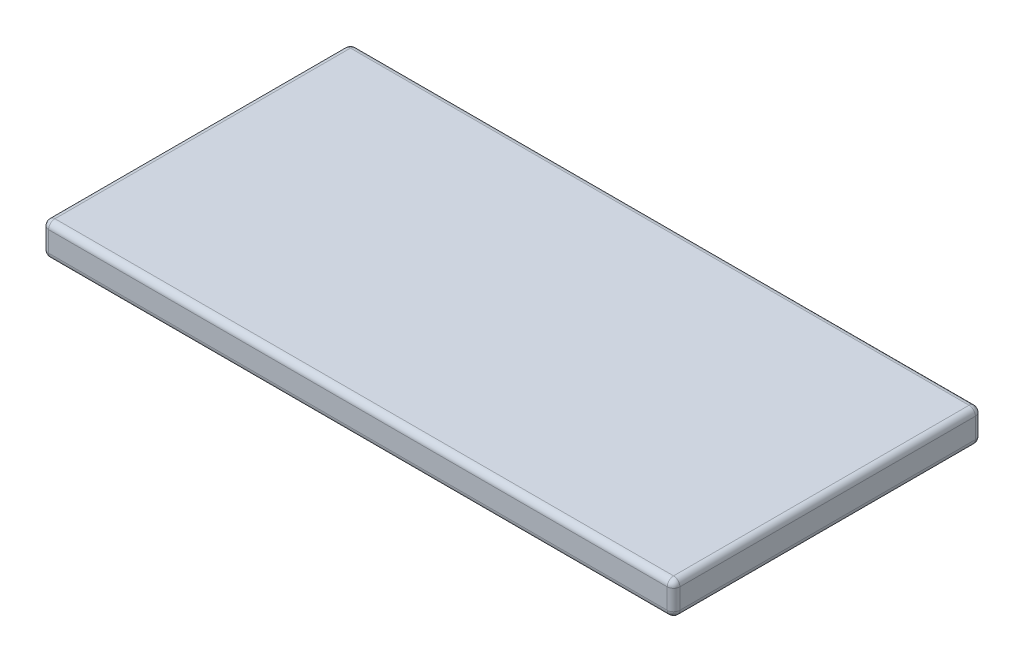
from build123d import *

# Parameters (mm, degrees)
SKETCH_1_W      = 99.64
SKETCH_1_H      = 48.64
EXTRUDE_1_DEPTH = 5.2
FILLET_1_R      = 1


with BuildPart() as part:
    # 草图1 → 凸台-拉伸1 (new body)
    with BuildSketch(Plane(origin=(0, 0, 0), x_dir=(1, 0, 0), z_dir=(0, 1, 0))):
        Rectangle(SKETCH_1_W, SKETCH_1_H)
    extrude(amount=EXTRUDE_1_DEPTH)

    # 圆角1
    fillet_1_edges = [part.edges().sort_by_distance(p)[0] for p in [
        (49.82, 5.2, 0),
        (0, 5.2, -24.32),
        (-49.82, 5.2, 0),
        (0, 0, -24.32),
        (49.82, 0, 0),
        (0, 0, 24.32),
        (-49.82, 0, 0),
        (0, 5.2, 24.32),
        (-49.82, 2.6, -24.32),
        (49.82, 2.6, -24.32),
        (49.82, 2.6, 24.32),
        (-49.82, 2.6, 24.32),
    ]]
    fillet(fillet_1_edges, radius=FILLET_1_R)


solid = part.part
